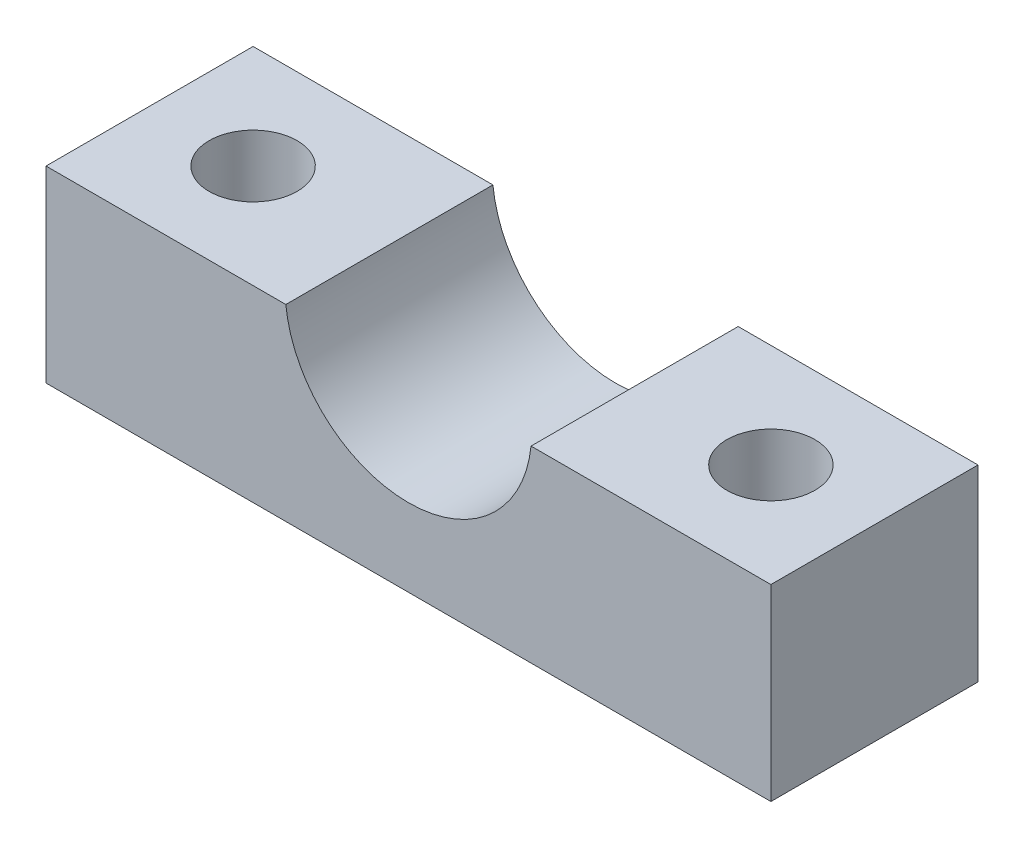
from build123d import *

# Parameters (mm, degrees)
BOSS_EXTRUDE1_DEPTH  = 4
M3_CLEARANCE_HOLE1_D = 3.4
CUT_EXTRUDE1_DEPTH   = 3


with BuildPart() as part:
    # Sketch1 → Boss-Extrude1 (new, symmetric)
    with BuildSketch(Plane.XY):
        with BuildLine():
            Line((14, -0.5), (4.736180555, -0.5))
            ThreePointArc((4.736180555, -0.5), (0, -4.7625), (-4.736180555, -0.5))
            Line((-4.736180555, -0.5), (-14, -0.5))
            Line((-14, -0.5), (-14, -7.76))
            Line((-14, -7.76), (14, -7.76))
            Line((14, -7.76), (14, -0.5))
        make_face()
    extrude(amount=BOSS_EXTRUDE1_DEPTH, both=True)

    # M3 Clearance Hole1 (through all)
    with Locations(Plane.XZ.offset(7.76)):
        with Locations((-10, 0), (10, 0)):
            Hole(M3_CLEARANCE_HOLE1_D / 2)

    # Sketch5 → Cut-Extrude1 (cut)
    with BuildSketch(Plane.XZ.offset(7.76)):
        Polygon((-7.25, -1.58771324), (-7.25, 1.58771324), (-10, 3.175426481), (-12.75, 1.58771324), (-12.75, -1.58771324), (-10, -3.175426481), align=None)
        Polygon((7.25, -1.58771324), (10, -3.175426481), (12.75, -1.58771324), (12.75, 1.58771324), (10, 3.175426481), (7.25, 1.58771324), align=None)
    extrude(amount=-CUT_EXTRUDE1_DEPTH, mode=Mode.SUBTRACT)


solid = part.part
